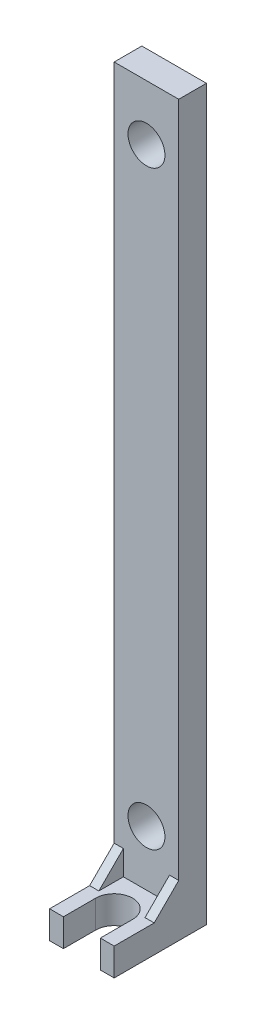
from build123d import *

# Parameters (mm, degrees)
SKETCH1_W           = 7
SKETCH1_H           = 79
SKETCH1_R           = 2
BOSS_EXTRUDE1_DEPTH = 3
SKETCH2_W           = 7
SKETCH2_H           = 3
BOSS_EXTRUDE2_DEPTH = 7
CUT_EXTRUDE1_REACH  = 81.707
BOSS_EXTRUDE3_DEPTH = 1


with BuildPart() as part:
    # Sketch1 → Boss-Extrude1 (new body)
    with BuildSketch(Plane.XY):
        Rectangle(SKETCH1_W, SKETCH1_H)
        with Locations((0, -30.5)):
            Circle(SKETCH1_R, mode=Mode.SUBTRACT)
        with Locations((0, 33.5)):
            Circle(SKETCH1_R, mode=Mode.SUBTRACT)
    extrude(amount=BOSS_EXTRUDE1_DEPTH)

    # Sketch2 → Boss-Extrude2 (add)
    with BuildSketch(Plane.XY.offset(3)):
        with Locations((0, -38)):
            Rectangle(SKETCH2_W, SKETCH2_H)
    extrude(amount=BOSS_EXTRUDE2_DEPTH)

    # Sketch3 → Cut-Extrude1 (cut, up to next)
    with BuildSketch(Plane.XZ.offset(39.5), mode=Mode.PRIVATE) as cut_extrude1_sk1:
        with BuildLine():
            Line((-2, 6.5), (-2, 10))
            Line((-2, 10), (2, 10))
            Line((2, 10), (2, 6.5))
            ThreePointArc((2, 6.5), (0, 4.5), (-2, 6.5))
        make_face()
    cut_extrude1_tool1 = extrude(cut_extrude1_sk1.sketch, amount=-CUT_EXTRUDE1_REACH, mode=Mode.PRIVATE) & part.part
    add(cut_extrude1_tool1.solids().sort_by_distance((0, -39.5, 7.444953))[0], mode=Mode.SUBTRACT)

    # Sketch4 → Boss-Extrude3 (add)
    with BuildSketch(Plane.ZY.offset(3.5)):
        Polygon((3, -33.839487464), (5.660512536, -36.5), (3, -36.5), align=None)
    boss_extrude3 = extrude(amount=-BOSS_EXTRUDE3_DEPTH)

    # Mirror1: Boss-Extrude3 across plane
    add(boss_extrude3.mirror(Plane.ZY))


solid = part.part
